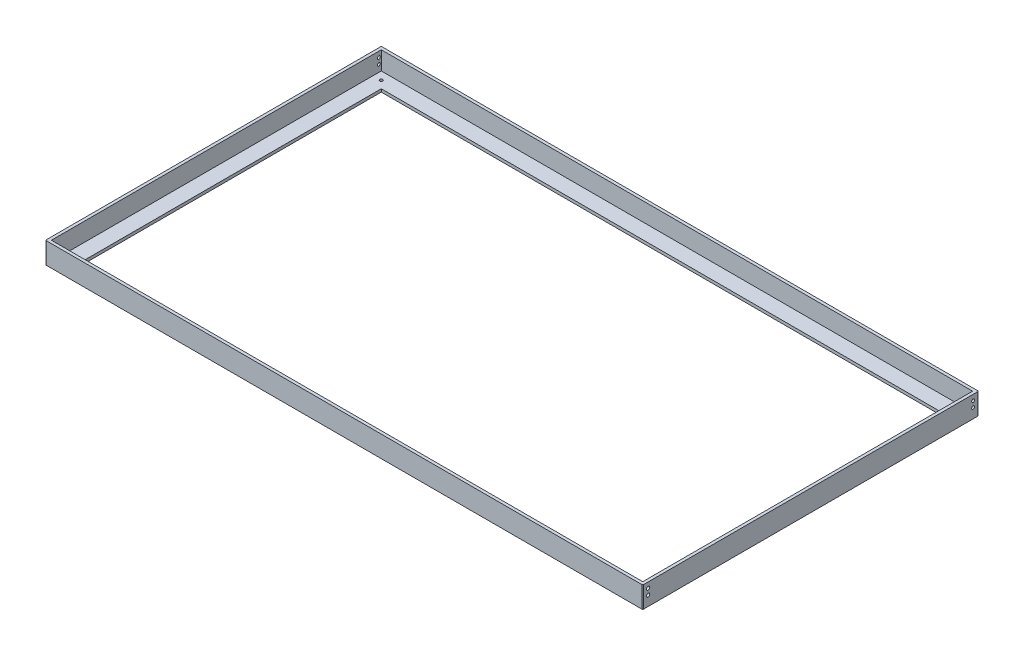
from build123d import *

# Parameters (mm, degrees)
SKETCH2_W           = 1626.4
SKETCH2_H           = 914.4
BOSS_EXTRUDE1_DEPTH = 100
SHELL1_T            = -10
SKETCH3_W           = 1526.4
SKETCH3_H           = 814.4
CUT_EXTRUDE1_DEPTH  = 1868.994732327
SKETCH8_W           = 914.4
SKETCH8_H           = 42
CUT_EXTRUDE5_DEPTH  = 1869.503229861
SKETCH9_R           = 4
CUT_EXTRUDE8_DEPTH  = 1867.72663237
SKETCH10_R          = 4
CUT_EXTRUDE9_DEPTH  = 1867.442691325
SKETCH11_W          = 1610.4
SKETCH11_H          = 898.4
CUT_EXTRUDE10_DEPTH = 50
FILLET1_R           = 2.4
SKETCH13_R          = 4.5
CUT_EXTRUDE11_DEPTH = 1867.72663237


with BuildPart() as part:
    # Sketch2 → Boss-Extrude1 (new body)
    with BuildSketch(Plane(origin=(0, 0, 0), x_dir=(1, 0, 0), z_dir=(0, 1, 0))):
        with Locations((813.2, 457.2)):
            Rectangle(SKETCH2_W, SKETCH2_H)
    extrude(amount=BOSS_EXTRUDE1_DEPTH)

    # Shell1
    shell1_openings = [part.faces().sort_by_distance(p)[0] for p in [
        (813.2, 100, -457.2),
    ]]
    offset(amount=SHELL1_T, openings=shell1_openings, kind=Kind.INTERSECTION)

    # Sketch3 → Cut-Extrude1 (cut, through all)
    with BuildSketch(Plane(origin=(0, 10, 0), x_dir=(1, 0, 0), z_dir=(0, 1, 0))):
        with Locations((813.2, 457.2)):
            Rectangle(SKETCH3_W, SKETCH3_H)
    extrude(amount=-CUT_EXTRUDE1_DEPTH, mode=Mode.SUBTRACT)

    # Sketch8 → Cut-Extrude5 (cut, through all)
    with BuildSketch(Plane(origin=(1626.4, 0, 0), x_dir=(0, 0, -1), z_dir=(1, 0, 0))):
        with Locations((457.2, 79)):
            Rectangle(SKETCH8_W, SKETCH8_H)
    extrude(amount=-CUT_EXTRUDE5_DEPTH, mode=Mode.SUBTRACT)

    # Sketch9 → Cut-Extrude8 (cut, through all)
    with BuildSketch(Plane(origin=(1626.4, 0, 0), x_dir=(0, 0, -1), z_dir=(1, 0, 0))):
        with Locations((899.7, 43)):
            Circle(SKETCH9_R)
        with Locations((899.7, 26.7)):
            Circle(SKETCH9_R)
    extrude(amount=-CUT_EXTRUDE8_DEPTH, mode=Mode.SUBTRACT)

    # Sketch10 → Cut-Extrude9 (cut, through all)
    with BuildSketch(Plane(origin=(0, 10, 0), x_dir=(1, 0, 0), z_dir=(0, 1, 0))):
        with Locations(Location((30, 884.4, 0), (0, 0, 270))):
            Circle(SKETCH10_R)
        with Locations(Location((30, 30, 0), (0, 0, 270))):
            Circle(SKETCH10_R)
        with Locations(Location((1596.4, 30, 0), (0, 0, 270))):
            Circle(SKETCH10_R)
        with Locations(Location((1596.4, 884.4, 0), (0, 0, 270))):
            Circle(SKETCH10_R)
    extrude(amount=-CUT_EXTRUDE9_DEPTH, mode=Mode.SUBTRACT)

    # Sketch11 → Cut-Extrude10 (cut)
    with BuildSketch(Plane(origin=(0, 58, 0), x_dir=(1, 0, 0), z_dir=(0, 1, 0))):
        with Locations((813.2, 457.2)):
            Rectangle(SKETCH11_W, SKETCH11_H)
    extrude(amount=-CUT_EXTRUDE10_DEPTH, mode=Mode.SUBTRACT)

    # Fillet1
    fillet1_edges = [part.edges().sort_by_distance(p)[0] for p in [
        (0, 29, -914.4),
        (1626.4, 29, -914.4),
        (1626.4, 29, 0),
        (0, 29, 0),
    ]]
    fillet(fillet1_edges, radius=FILLET1_R)

    # Sketch13 → Cut-Extrude11 (cut, through all)
    with BuildSketch(Plane(origin=(1626.4, 0, 0), x_dir=(0, 0, -1), z_dir=(1, 0, 0))):
        with Locations((14.7, 43)):
            Circle(SKETCH13_R)
        with Locations((14.626959673, 26.7)):
            Circle(SKETCH13_R)
    extrude(amount=-CUT_EXTRUDE11_DEPTH, mode=Mode.SUBTRACT)


solid = part.part
